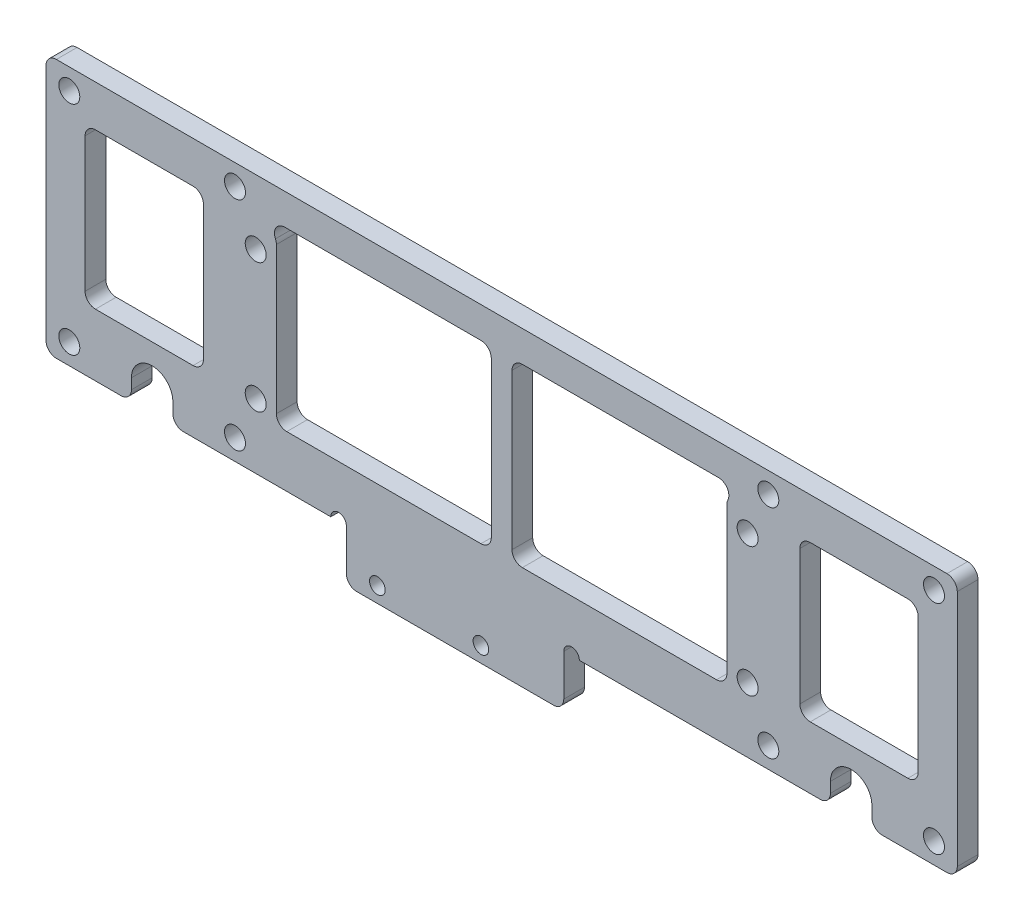
from build123d import *

# Parameters (mm, degrees)
SKETCH_1_W          = 176
SKETCH_1_H          = 50
EXTRUDE_1_DEPTH     = 2
SKETCH_2_R          = 2.025
CUT_EXTRUDE_1_DEPTH = 22
CUT_EXTRUDE_2_DEPTH = 17
FILLET_1_R          = 2
SKETCH_4_R          = 2.025
CUT_EXTRUDE_3_DEPTH = 5
CUT_EXTRUDE_5_DEPTH = 15.5
SKETCH_8_W          = 22.857142857
SKETCH_8_H          = 30
CUT_EXTRUDE_6_DEPTH = 15.5
FILLET_2_R          = 2
SKETCH_11_W         = 42
SKETCH_11_H         = 10
EXTRUDE_4_DEPTH     = 4
SKETCH_12_R         = 1.51
CUT_EXTRUDE_8_DEPTH = 4
SKETCH_13_R         = 1.5
CUT_EXTRUDE_9_DEPTH = 10
EXTRUDE_5_DEPTH     = 4
FILLET_3_R          = 2
FILLET_4_R          = 2


with BuildPart() as part:
    # 草图1 → 凸台-拉伸1 (new, symmetric)
    with BuildSketch(Plane.XY):
        Rectangle(SKETCH_1_W, SKETCH_1_H)
    extrude(amount=EXTRUDE_1_DEPTH, both=True)

    # 草图2 → 切除-拉伸1 (cut, symmetric)
    with BuildSketch(Plane(origin=(0, 0, -2), x_dir=(-1, 0, 0), z_dir=(0, 0, -1))):
        with Locations((51.5, 21)):
            Circle(SKETCH_2_R)
        with Locations((51.5, -21)):
            Circle(SKETCH_2_R)
        with Locations((83.5, 21)):
            Circle(SKETCH_2_R)
        with Locations((83.5, -21)):
            Circle(SKETCH_2_R)
    cut_extrude_1 = extrude(amount=CUT_EXTRUDE_1_DEPTH, both=True, mode=Mode.SUBTRACT)

    # 镜向1: 切除-拉伸1 across plane
    add(cut_extrude_1.mirror(Plane(origin=(0, 0, 0), x_dir=(0, 0, 1), z_dir=(1, 0, 0))), mode=Mode.SUBTRACT)

    # 草图3 → 切除-拉伸2 (cut, symmetric)
    with BuildSketch(Plane(origin=(0, 0, -2), x_dir=(-1, 0, 0), z_dir=(0, 0, -1))):
        with BuildLine():
            Line((63.5, -21), (63.5, -25))
            Line((63.5, -25), (71.5, -25))
            Line((71.5, -25), (71.5, -21))
            ThreePointArc((71.5, -21), (67.5, -17), (63.5, -21))
        make_face()
    cut_extrude_2 = extrude(amount=CUT_EXTRUDE_2_DEPTH, both=True, mode=Mode.SUBTRACT)

    # 镜向2: 切除-拉伸2 across plane
    add(cut_extrude_2.mirror(Plane(origin=(0, 0, 0), x_dir=(0, 0, 1), z_dir=(1, 0, 0))), mode=Mode.SUBTRACT)

    # 圆角1
    fillet_1_edges = [part.edges().sort_by_distance(p)[0] for p in [
        (-71.5, -25, 0),
        (-63.5, -25, 0),
        (88, -25, 0),
        (-88, -25, 0),
        (-88, 25, 0),
        (88, 25, 0),
        (63.5, -25, 0),
        (71.5, -25, 0),
    ]]
    fillet(fillet_1_edges, radius=FILLET_1_R)

    # 草图4 → 切除-拉伸3 (cut, symmetric)
    with BuildSketch(Plane(origin=(0, 0, -2), x_dir=(-1, 0, 0), z_dir=(0, 0, -1))):
        with Locations((47.5, -12.5)):
            Circle(SKETCH_4_R)
        with Locations((47.5, 12.5)):
            Circle(SKETCH_4_R)
        with Locations((-47.5, 12.5)):
            Circle(SKETCH_4_R)
        with Locations((-47.5, -12.5)):
            Circle(SKETCH_4_R)
    extrude(amount=CUT_EXTRUDE_3_DEPTH, both=True, mode=Mode.SUBTRACT)

    # 草图7 → 切除-拉伸5 (cut, symmetric)
    with BuildSketch(Plane.XY.offset(2)):
        Polygon((-2, 19), (-45.032854639, 19), (-43.5, 15.742683893), (-43.5, -15.742683893), (-45.032854639, -19), (-2, -19), align=None)
        Polygon((45.032854639, 19), (2, 19), (2, -19), (45.032854639, -19), (43.5, -15.742683893), (43.5, 15.742683893), align=None)
    extrude(amount=CUT_EXTRUDE_5_DEPTH, both=True, mode=Mode.SUBTRACT)

    # 草图8 → 切除-拉伸6 (cut, symmetric)
    with BuildSketch(Plane.XY.offset(2)):
        with Locations((-69.023809524, 2)):
            Rectangle(SKETCH_8_W, SKETCH_8_H)
        with Locations((69.023809524, 2)):
            Rectangle(SKETCH_8_W, SKETCH_8_H)
    extrude(amount=CUT_EXTRUDE_6_DEPTH, both=True, mode=Mode.SUBTRACT)

    # 圆角2
    fillet_2_edges = [part.edges().sort_by_distance(p)[0] for p in [
        (-2, 19, 0),
        (-2, -19, 0),
        (-45.032854639, -19, 0),
        (-43.5, -15.742683893, 0),
        (-43.5, 15.742683893, 0),
        (-45.032854639, 19, 0),
        (2, 19, 0),
        (45.032854639, 19, 0),
        (43.5, 15.742683893, 0),
        (43.5, -15.742683893, 0),
        (45.032854639, -19, 0),
        (2, -19, 0),
        (-80.452380952, -13, 0),
        (-80.452380952, 17, 0),
        (-57.595238095, 17, 0),
        (-57.595238095, -13, 0),
        (80.452380952, 17, 0),
        (80.452380952, -13, 0),
        (57.595238095, -13, 0),
        (57.595238095, 17, 0),
    ]]
    fillet(fillet_2_edges, radius=FILLET_2_R)

    # 草图11 → 凸台-拉伸4 (add)
    with BuildSketch(Plane.XY.offset(2)):
        with Locations((-9, -30)):
            Rectangle(SKETCH_11_W, SKETCH_11_H)
    extrude(amount=-EXTRUDE_4_DEPTH)

    # 草图12 → 切除-拉伸8 (cut)
    with BuildSketch(Plane.XY.offset(2)):
        with Locations((-4, -32)):
            Circle(SKETCH_12_R)
        with Locations((-24, -32)):
            Circle(SKETCH_12_R)
    extrude(amount=-CUT_EXTRUDE_8_DEPTH, mode=Mode.SUBTRACT)

    # 草图13 → 切除-拉伸9 (cut)
    with BuildSketch(Plane.XY.offset(2)):
        with Locations((-31.5, -25)):
            Circle(SKETCH_13_R)
        with Locations((13.5, -25)):
            Circle(SKETCH_13_R)
    extrude(amount=-CUT_EXTRUDE_9_DEPTH, mode=Mode.SUBTRACT)

    # 草图14 → 凸台-拉伸5 (add)
    with BuildSketch(Plane.XY.offset(2)):
        with BuildLine():
            Line((-2, -15), (-43.5, -15))
            Line((-43.5, -15), (-43.5, -15.295610336))
            ThreePointArc((-43.5, -15.295610336), (-43.548170754, -15.731915957), (-43.690362596, -16.147204408))
            Line((-43.690362596, -16.147204408), (-43.690928016, -16.148405927))
            ThreePointArc((-43.690928016, -16.148405927), (-43.569956971, -18.071637032), (-41.881290612, -19))
            Line((-41.881290612, -19), (-4, -19))
            ThreePointArc((-4, -19), (-2.585786438, -18.414213562), (-2, -17))
            Line((-2, -17), (-2, -15))
        make_face()
        with BuildLine():
            Line((43.5, -15), (2, -15))
            Line((2, -15), (2, -17))
            ThreePointArc((2, -17), (2.585786438, -18.414213562), (4, -19))
            Line((4, -19), (41.881290612, -19))
            ThreePointArc((41.881290612, -19), (43.569956971, -18.071637032), (43.690928016, -16.148405927))
            Line((43.690928016, -16.148405927), (43.690362596, -16.147204408))
            ThreePointArc((43.690362596, -16.147204408), (43.548170754, -15.731915957), (43.5, -15.295610336))
            Line((43.5, -15.295610336), (43.5, -15))
        make_face()
    extrude(amount=-EXTRUDE_5_DEPTH)

    # 圆角3
    fillet_3_edges = [part.edges().sort_by_distance(p)[0] for p in [
        (-2, -15, 0),
        (-43.5, -15, 0),
        (43.5, -15, 0),
        (2, -15, 0),
    ]]
    fillet(fillet_3_edges, radius=FILLET_3_R)

    # 圆角4
    fillet_4_edges = [part.edges().sort_by_distance(p)[0] for p in [
        (12, -35, 0),
        (-30, -35, 0),
    ]]
    fillet(fillet_4_edges, radius=FILLET_4_R)


solid = part.part
